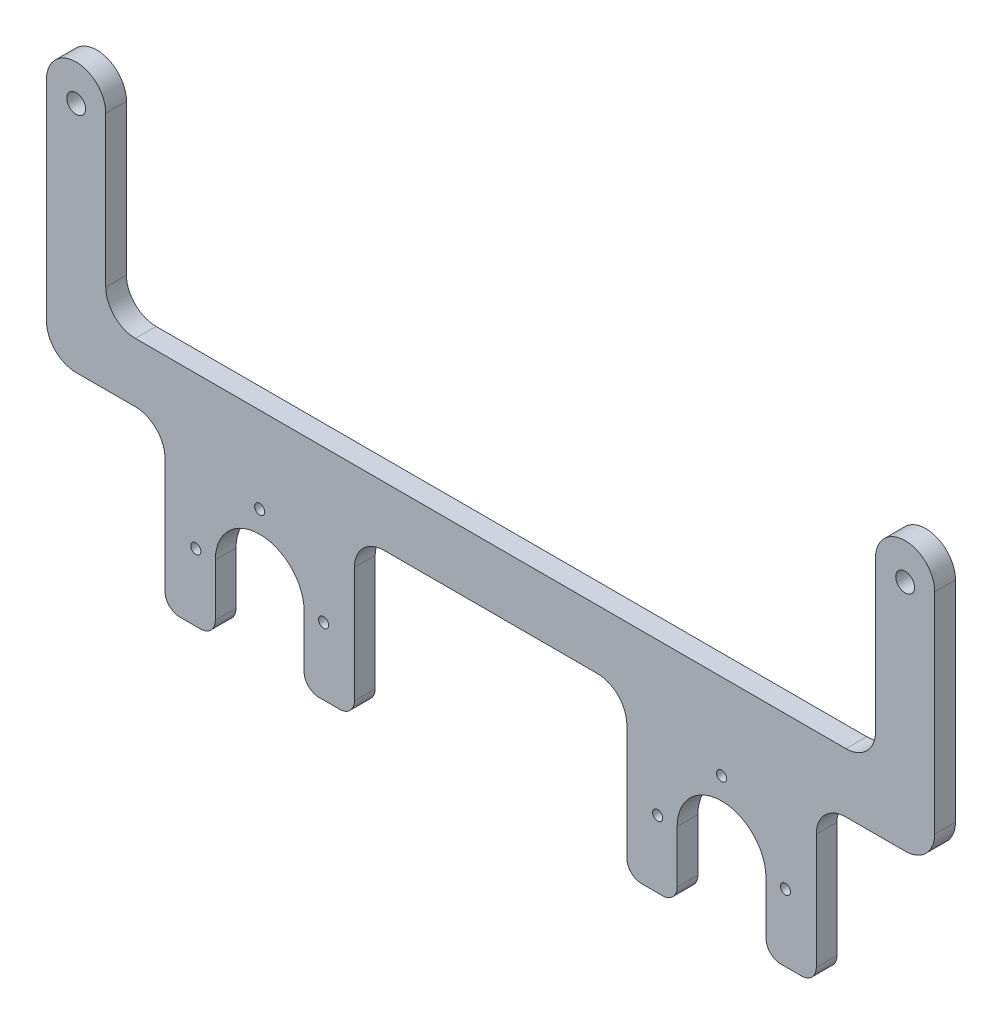
from build123d import *

# Parameters (mm, degrees)
SKETCH1_R           = 1.7
SKETCH1_R_2         = 3.175
BOSS_EXTRUDE1_DEPTH = 7


with BuildPart() as part:
    # Sketch1 → Boss-Extrude1 (new body)
    with BuildSketch(Plane.XY.offset(7)):
        with BuildLine():
            Line((100.400666143, -62.126245847), (107.400666143, -62.126245847))
            ThreePointArc((107.400666143, -62.126245847), (110.936200049, -60.661779753), (112.400666143, -57.126245847))
            Line((112.400666143, -57.126245847), (112.400666143, -39.418346536))
            ThreePointArc((112.400666143, -39.418346536), (127.400666143, -24.418346536), (142.400666143, -39.418346536))
            Line((142.400666143, -39.418346536), (142.400666143, -57.126245847))
            ThreePointArc((142.400666143, -57.126245847), (143.865132237, -60.661779753), (147.400666143, -62.126245847))
            Line((147.400666143, -62.126245847), (154.400666143, -62.126245847))
            ThreePointArc((154.400666143, -62.126245847), (157.936200049, -60.661779753), (159.400666143, -57.126245847))
            Line((159.400666143, -57.126245847), (159.400666143, -18.126245847))
            ThreePointArc((159.400666143, -18.126245847), (162.329598331, -11.055178035), (169.400666143, -8.126245847))
            Line((169.400666143, -8.126245847), (189.400666143, -8.126245847))
            ThreePointArc((189.400666143, -8.126245847), (196.471733955, -5.197313659), (199.400666143, 1.873754153))
            Line((199.400666143, 1.873754153), (199.400666143, 72.724252492))
            ThreePointArc((199.400666143, 72.724252492), (189.400666143, 82.724252492), (179.400666143, 72.724252492))
            Line((179.400666143, 72.724252492), (179.400666143, 21.873754153))
            ThreePointArc((179.400666143, 21.873754153), (176.471733955, 14.802686341), (169.400666143, 11.873754153))
            Line((169.400666143, 11.873754153), (-70.599333857, 11.873754153))
            ThreePointArc((-70.599333857, 11.873754153), (-77.670401669, 14.802686341), (-80.599333857, 21.873754153))
            Line((-80.599333857, 21.873754153), (-80.599333857, 72.724252492))
            ThreePointArc((-80.599333857, 72.724252492), (-90.599333857, 82.724252492), (-100.599333857, 72.724252492))
            Line((-100.599333857, 72.724252492), (-100.599333857, 1.873754153))
            ThreePointArc((-100.599333857, 1.873754153), (-97.670401669, -5.197313659), (-90.599333857, -8.126245847))
            Line((-90.599333857, -8.126245847), (-70.599333857, -8.126245847))
            ThreePointArc((-70.599333857, -8.126245847), (-63.528266045, -11.055178035), (-60.599333857, -18.126245847))
            Line((-60.599333857, -18.126245847), (-60.599333857, -57.126245847))
            ThreePointArc((-60.599333857, -57.126245847), (-59.134867763, -60.661779753), (-55.599333857, -62.126245847))
            Line((-55.599333857, -62.126245847), (-48.599333857, -62.126245847))
            ThreePointArc((-48.599333857, -62.126245847), (-45.063799951, -60.661779753), (-43.599333857, -57.126245847))
            Line((-43.599333857, -57.126245847), (-43.599333857, -39.418346536))
            ThreePointArc((-43.599333857, -39.418346536), (-28.599333857, -24.418346536), (-13.599333857, -39.418346536))
            Line((-13.599333857, -39.418346536), (-13.599333857, -57.126245847))
            ThreePointArc((-13.599333857, -57.126245847), (-12.134867763, -60.661779753), (-8.599333857, -62.126245847))
            Line((-8.599333857, -62.126245847), (-1.599333857, -62.126245847))
            ThreePointArc((-1.599333857, -62.126245847), (1.936200049, -60.661779753), (3.400666143, -57.126245847))
            Line((3.400666143, -57.126245847), (3.400666143, -18.126245847))
            ThreePointArc((3.400666143, -18.126245847), (6.329598331, -11.055178035), (13.400666143, -8.126245847))
            Line((13.400666143, -8.126245847), (85.400666143, -8.126245847))
            ThreePointArc((85.400666143, -8.126245847), (92.471733955, -11.055178035), (95.400666143, -18.126245847))
            Line((95.400666143, -18.126245847), (95.400666143, -57.126245847))
            ThreePointArc((95.400666143, -57.126245847), (96.865132237, -60.661779753), (100.400666143, -62.126245847))
        make_face()
        with Locations((-50.189333857, -39.418346536)):
            Circle(SKETCH1_R, mode=Mode.SUBTRACT)
        with Locations((-7.009333857, -39.418346536)):
            Circle(SKETCH1_R, mode=Mode.SUBTRACT)
        with Locations((-28.599333857, -17.066346536)):
            Circle(SKETCH1_R, mode=Mode.SUBTRACT)
        with Locations((-90.599333857, 70.581653464)):
            Circle(SKETCH1_R_2, mode=Mode.SUBTRACT)
        with Locations(Location((189.400666143, 70.581653464, 0), (0, 0, 180))):
            Circle(SKETCH1_R_2, mode=Mode.SUBTRACT)
        with Locations(Location((127.400666143, -17.066346536, 0), (0, 0, 180))):
            Circle(SKETCH1_R, mode=Mode.SUBTRACT)
        with Locations(Location((105.810666143, -39.418346536, 0), (0, 0, 180))):
            Circle(SKETCH1_R, mode=Mode.SUBTRACT)
        with Locations(Location((148.990666143, -39.418346536, 0), (0, 0, 180))):
            Circle(SKETCH1_R, mode=Mode.SUBTRACT)
    extrude(amount=-BOSS_EXTRUDE1_DEPTH)


solid = part.part
